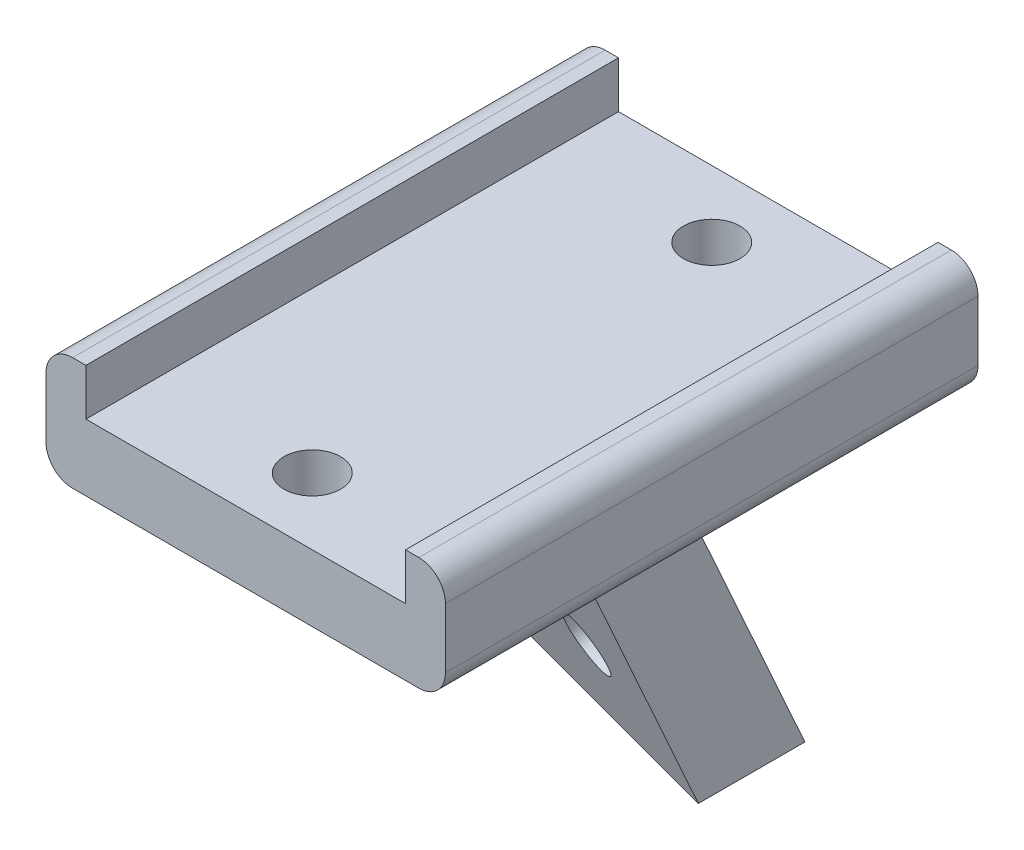
from build123d import *

# Parameters (mm, degrees)
SKETCH1_W           = 22
SKETCH1_H           = 40
SKETCH1_R           = 2.125
BOSS_EXTRUDE1_DEPTH = 5
BOSS_EXTRUDE3_DEPTH = 40
FILLET1_R           = 2
SKETCH6_R           = 2.125
CUT_EXTRUDE1_DEPTH  = 7.086873748


with BuildPart() as part:
    # Sketch1 → Boss-Extrude1 (new body)
    with BuildSketch(Plane(origin=(0, 0, 0), x_dir=(1, 0, 0), z_dir=(0, 1, 0))):
        Rectangle(SKETCH1_W, SKETCH1_H)
        with Locations(Location((0, 15, 0), (0, 0, 270))):
            Circle(SKETCH1_R, mode=Mode.SUBTRACT)
        with Locations(Location((0, -15, 0), (0, 0, 270))):
            Circle(SKETCH1_R, mode=Mode.SUBTRACT)
    extrude(amount=BOSS_EXTRUDE1_DEPTH)

    # Sketch4 → Boss-Extrude3 (add)
    with BuildSketch(Plane(origin=(0, 0, -20), x_dir=(-1, 0, 0), z_dir=(0, 0, -1))):
        Polygon((-11, 5), (-12, 5), (-12, 8.5), (-15, 8.5), (-15, 0), (-11, 0), align=None)
        Polygon((11, 0), (11, 5), (12, 5), (12, 8.5), (15, 8.5), (15, 0), align=None)
    extrude(amount=-BOSS_EXTRUDE3_DEPTH)

    # Fillet1
    fillet1_edges = [part.edges().sort_by_distance(p)[0] for p in [
        (15, 0, 0),
        (15, 8.5, 0),
        (-15, 0, 0),
        (-15, 8.5, 0),
    ]]
    fillet(fillet1_edges, radius=FILLET1_R)

    # Sketch2 → Loft1 section 0
    with BuildSketch(Plane.XZ):
        with BuildLine():
            Line((-11, 0.105117767), (11, 6))
            Line((11, 6), (11, -2))
            Line((11, -2), (-11, -7.894882233))
            Line((-11, -7.894882233), (-11, 0.105117767))
        make_face()
    # Sketch5 → Loft1 section 1
    with BuildSketch(Plane(origin=(0, -20, 0), x_dir=(-1, 0, 0), z_dir=(0, -1, 0))):
        with BuildLine():
            Line((-11, 3), (-11, 11))
            Line((-11, 11), (11, 16.894882233))
            Line((11, 16.894882233), (11, 8.894882233))
            Line((11, 8.894882233), (-11, 3))
        make_face()
    loft()

    # Sketch6 → Cut-Extrude1 (cut)
    with BuildSketch(Plane(origin=(1.040309356, 1.747119317, -3.882487372), x_dir=(0.9714204714250083, -0.09740631922929449, 0.21645848717621435), z_dir=(-0.2373652621939752, -0.3986366483069059, 0.8858592184598079))):
        with Locations(Location((5.252708211, -11.411685947, 0), (0, 0, 90))):
            Circle(SKETCH6_R)
        with Locations(Location((-7.39453945, -12.762593713, 0), (0, 0, 90))):
            Circle(SKETCH6_R)
    extrude(amount=CUT_EXTRUDE1_DEPTH, mode=Mode.SUBTRACT)


solid = part.part
